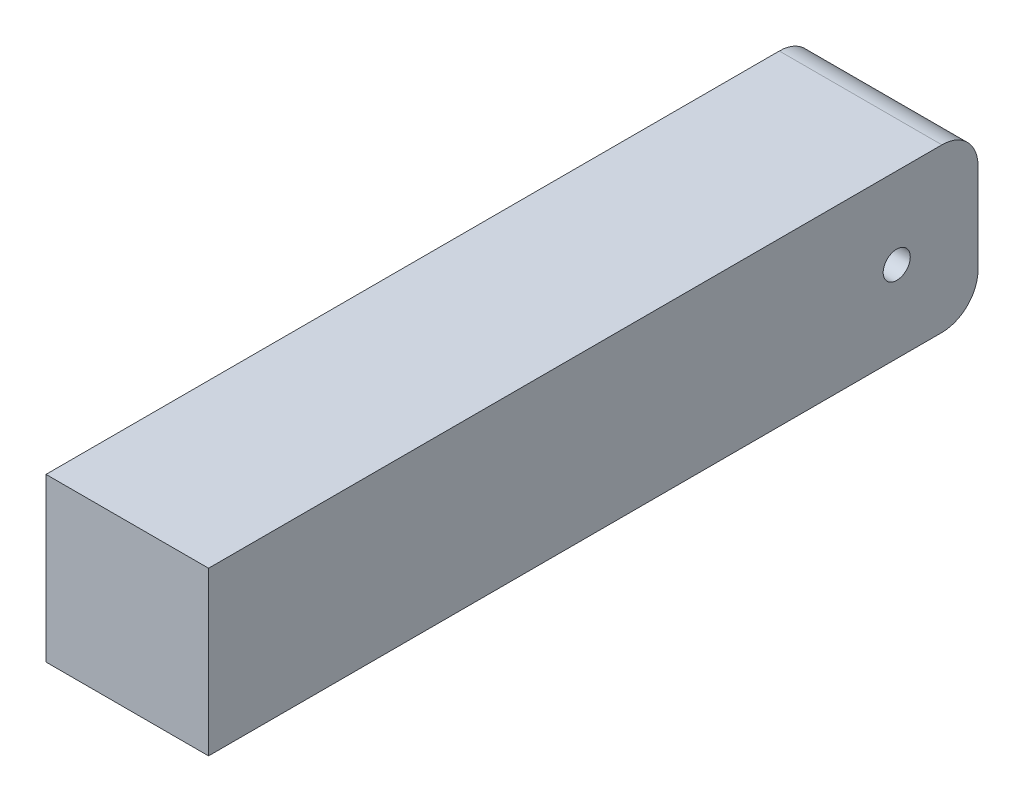
from build123d import *

# Parameters (mm, degrees)
SKETCH1_W           = 85.2
SKETCH1_H           = 18
SKETCH1_R           = 1.5
BOSS_EXTRUDE1_DEPTH = 18
SKETCH2_R           = 3
CUT_EXTRUDE1_DEPTH  = 8
FILLET1_R           = 4


with BuildPart() as part:
    # Sketch1 → Boss-Extrude1 (new body)
    with BuildSketch(Plane(origin=(0, 0, 0), x_dir=(0, 0, -1), z_dir=(1, 0, 0))):
        with Locations((42.6, 9)):
            Rectangle(SKETCH1_W, SKETCH1_H)
        with Locations((76.2, 9)):
            Circle(SKETCH1_R, mode=Mode.SUBTRACT)
    extrude(amount=BOSS_EXTRUDE1_DEPTH)

    # Sketch2 → Cut-Extrude1 (cut)
    with BuildSketch(Plane.ZY):
        with Locations((-76.2, 9)):
            Circle(SKETCH2_R)
    extrude(amount=-CUT_EXTRUDE1_DEPTH, mode=Mode.SUBTRACT)

    # Fillet1
    fillet1_edges = [part.edges().sort_by_distance(p)[0] for p in [
        (9, 18, -85.2),
        (9, 0, -85.2),
    ]]
    fillet(fillet1_edges, radius=FILLET1_R)


solid = part.part
